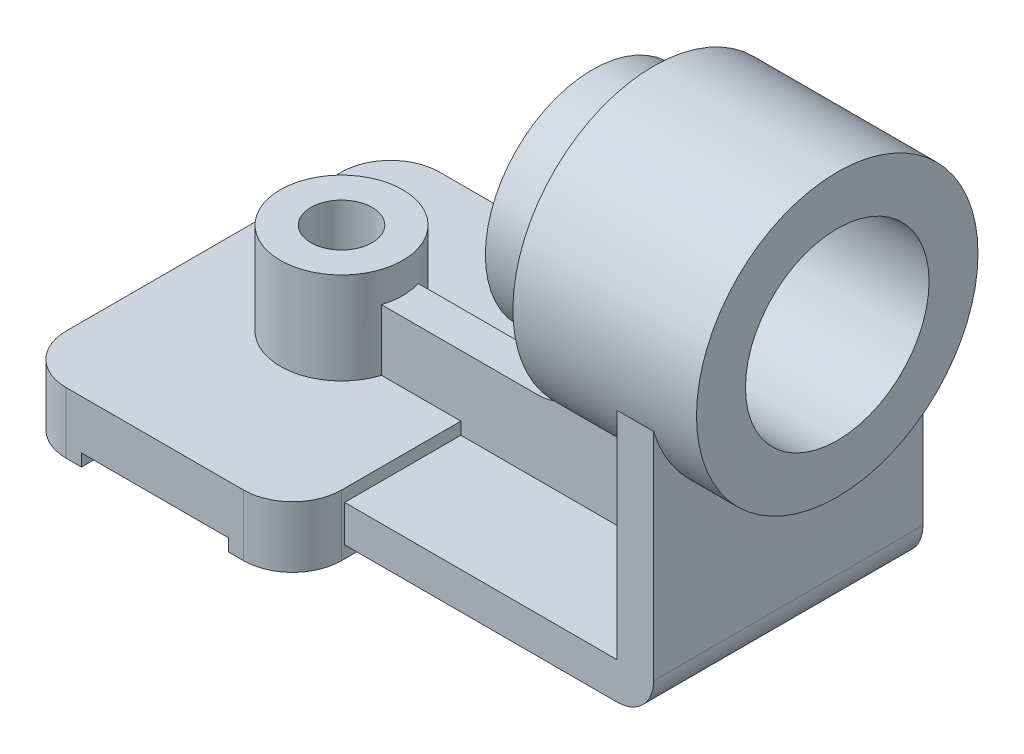
from build123d import *

# Parameters (mm, degrees)
EXTRUDE_1_DEPTH     = 10
SKETCH_2_R          = 10
EXTRUDE_2_DEPTH     = 15
SKETCH_3_W          = 24
SKETCH_3_H          = 4
CUT_EXTRUDE_1_DEPTH = 61
SKETCH_4_R          = 5
CUT_EXTRUDE_2_DEPTH = 23
EXTRUDE_3_DEPTH     = 22
EXTRUDE_4_DEPTH     = 3
EXTRUDE_START       = 8
SKETCH_7_R          = 23
EXTRUDE_5_DEPTH     = 30
SKETCH_9_R          = 17.5
EXTRUDE_6_DEPTH     = 10
SKETCH_10_R         = 10
CUT_EXTRUDE_3_DEPTH = 15
SKETCH_12_R         = 17
CUT_EXTRUDE_4_DEPTH = 3
SKETCH_13_R         = 15
CUT_EXTRUDE_5_DEPTH = 22


with BuildPart() as part:
    # 草图1 → 凸台-拉伸1 (new body)
    with BuildSketch(Plane(origin=(0, 0, 0), x_dir=(1, 0, 0), z_dir=(0, 1, 0))):
        with BuildLine():
            Line((-14.5, 30.5), (14.5, 30.5))
            ThreePointArc((14.5, 30.5), (20.156854249, 28.156854249), (22.5, 22.5))
            Line((22.5, 22.5), (22.5, -22.5))
            ThreePointArc((22.5, -22.5), (20.156854249, -28.156854249), (14.5, -30.5))
            Line((14.5, -30.5), (-14.5, -30.5))
            ThreePointArc((-14.5, -30.5), (-20.156854249, -28.156854249), (-22.5, -22.5))
            Line((-22.5, -22.5), (-22.5, 22.5))
            ThreePointArc((-22.5, 22.5), (-20.156854249, 28.156854249), (-14.5, 30.5))
        make_face()
    extrude(amount=-EXTRUDE_1_DEPTH)

    # 草图2 → 凸台-拉伸2 (add)
    with BuildSketch(Plane(origin=(0, 0, 0), x_dir=(1, 0, 0), z_dir=(0, 1, 0))):
        with Locations(Location((0, 0, 0), (0, 0, 270))):
            Circle(SKETCH_2_R)
    extrude(amount=EXTRUDE_2_DEPTH)

    # 草图3 → 切除-拉伸1 (cut)
    with BuildSketch(Plane.XY.offset(30.5)):
        with Locations((0, -10)):
            Rectangle(SKETCH_3_W, SKETCH_3_H)
    extrude(amount=-CUT_EXTRUDE_1_DEPTH, mode=Mode.SUBTRACT)

    # 草图4 → 切除-拉伸2 (cut)
    with BuildSketch(Plane(origin=(0, 15, 0), x_dir=(1, 0, 0), z_dir=(0, 1, 0))):
        with Locations(Location((0, 0, 0), (0, 0, 270))):
            Circle(SKETCH_4_R)
    extrude(amount=-CUT_EXTRUDE_2_DEPTH, mode=Mode.SUBTRACT)

    # 草图6 → 凸台-拉伸3 (add, symmetric)
    with BuildSketch(Plane.XY):
        with BuildLine():
            Line((22.5, -8), (67, -8))
            ThreePointArc((67, -8), (71.242640687, -6.242640687), (73, -2))
            Line((73, -2), (73, 40))
            Line((73, 40), (67, 40))
            Line((67, 40), (67, -2))
            Line((67, -2), (22.5, -2))
            Line((22.5, -2), (22.5, -8))
        make_face()
    extrude(amount=EXTRUDE_3_DEPTH, both=True)

    # 草图6<3> → 凸台-拉伸4 (add, symmetric)
    with BuildSketch(Plane.XY):
        with BuildLine():
            ThreePointArc((35, 10), (40.656854249, 12.343145751), (43, 18))
            Line((43, 18), (43, 40))
            Line((43, 40), (67, 40))
            Line((67, 40), (67, -2))
            Line((67, -2), (22.5, -2))
            Line((22.5, -2), (6.5, -2))
            Line((6.5, -2), (6.5, 10))
            Line((6.5, 10), (35, 10))
        make_face()
    extrude(amount=EXTRUDE_4_DEPTH, both=True)

    # 草图7 → 凸台-拉伸5 (add)
    with BuildSketch(Plane(origin=(73, 0, 0), x_dir=(0, 0, -1), z_dir=(1, 0, 0)).offset(EXTRUDE_START)):
        with Locations((0, 40)):
            Circle(SKETCH_7_R)
    extrude(amount=-EXTRUDE_5_DEPTH)

    # 草图9 → 凸台-拉伸6 (add)
    with BuildSketch(Plane.ZY.offset(-51)):
        with Locations(Location((0, 40, 0), (0, 0, 260.129110394))):
            Circle(SKETCH_9_R)
    extrude(amount=EXTRUDE_6_DEPTH)

    # 草图10 → 切除-拉伸3 (cut)
    with BuildSketch(Plane.ZY.offset(-41)):
        with Locations((0, 40)):
            Circle(SKETCH_10_R)
    extrude(amount=-CUT_EXTRUDE_3_DEPTH, mode=Mode.SUBTRACT)

    # 草图12 → 切除-拉伸4 (cut)
    with BuildSketch(Plane.ZY.offset(-56)):
        with Locations((0, 40)):
            Circle(SKETCH_12_R)
    extrude(amount=-CUT_EXTRUDE_4_DEPTH, mode=Mode.SUBTRACT)

    # 草图13 → 切除-拉伸5 (cut)
    with BuildSketch(Plane.ZY.offset(-59)):
        with Locations((0, 40)):
            Circle(SKETCH_13_R)
    extrude(amount=-CUT_EXTRUDE_5_DEPTH, mode=Mode.SUBTRACT)


solid = part.part
